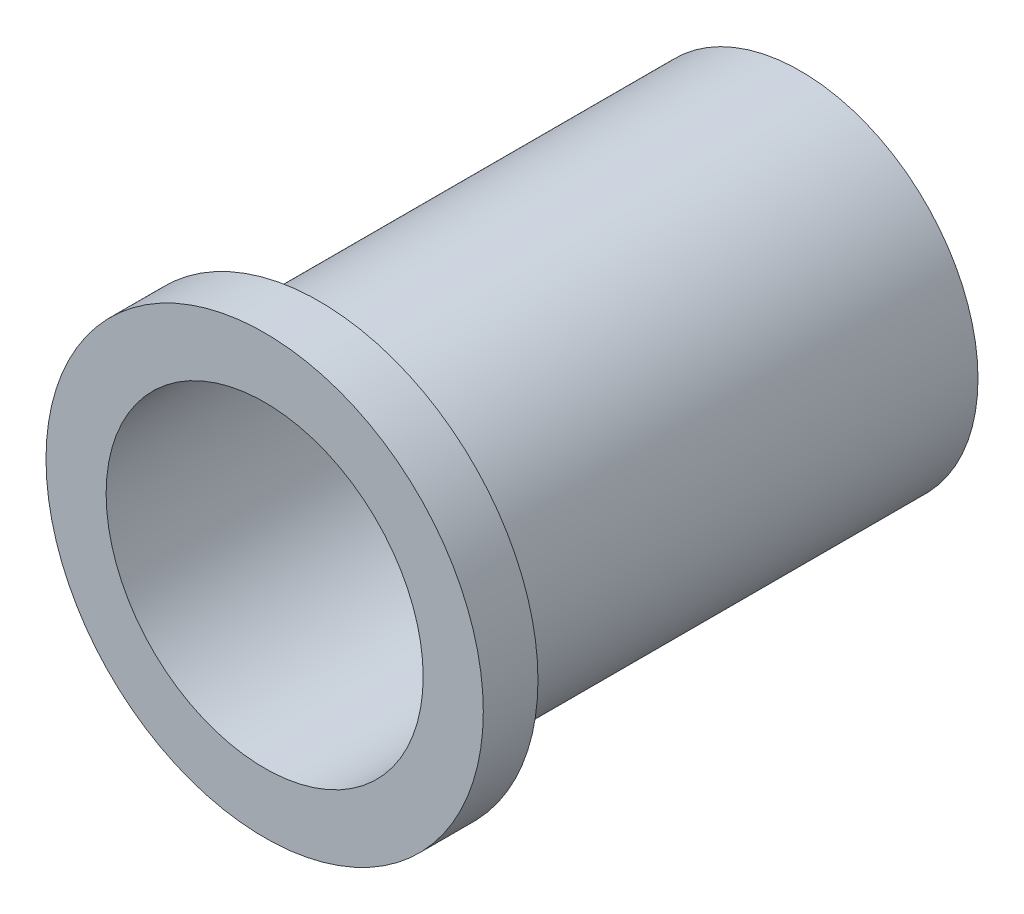
from build123d import *


with BuildPart() as part:
    # Sketch1 → Revolve1 (revolve)
    with BuildSketch(Plane.XZ.offset(-14.196461829), mode=Mode.PRIVATE) as revolve1_sk:
        Polygon((13.903227856, -1.7), (13.903227856, -7), (15.553227856, -7), (15.553227856, 1.8), (16.303227856, 1.8), (16.303227856, 2.8), (15.203227856, 2.8), (15.203227856, -1.7), align=None)
    revolve(revolve1_sk.sketch.rotate(Axis((12.303227856, 14.196461829, 5), (0, 0, -1)), 180), axis=Axis((12.303227856, 14.196461829, 5), (0, 0, -1)))


solid = part.part
